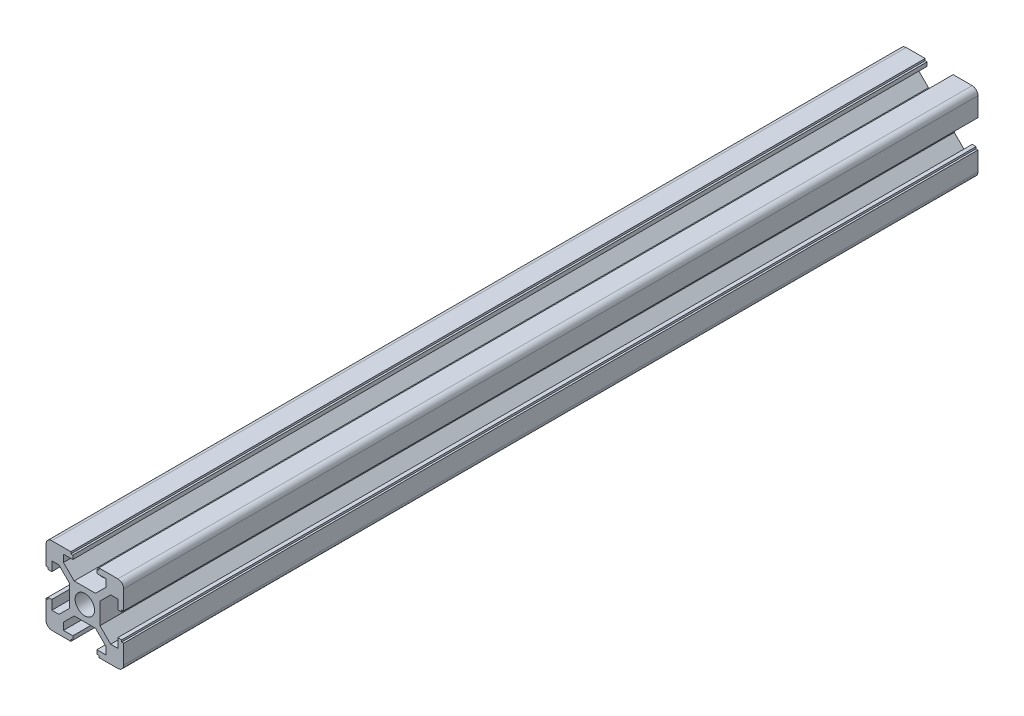
from build123d import *

# Parameters (mm, degrees)
SKETCH1_R           = 2.5
EXTRUDE_1_DEPTH     = 220
SKETCH_1_R          = 1.5
CUT_EXTRUDE_1_DEPTH = 221.665380157


with BuildPart() as part:
    # Sketch1 → 凸台-拉伸1 (new body)
    with BuildSketch(Plane.XY):
        with BuildLine():
            Line((-3.6, 10), (-3.6, 9.5))
            Line((-3.6, 9.5), (-3.1, 9.5))
            Line((-3.1, 9.5), (-3.1, 8.5))
            Line((-3.1, 8.5), (-5.5, 8.5))
            Line((-5.5, 8.5), (-5.5, 6.65))
            Line((-5.5, 6.65), (-2.75, 3.9))
            Line((-2.75, 3.9), (2.75, 3.9))
            Line((2.75, 3.9), (5.5, 6.65))
            Line((5.5, 6.65), (5.5, 8.5))
            Line((5.5, 8.5), (3.1, 8.5))
            Line((3.1, 8.5), (3.1, 9.5))
            Line((3.1, 9.5), (3.6, 9.5))
            Line((3.6, 9.5), (3.6, 10))
            Line((3.6, 10), (8.5, 10))
            ThreePointArc((8.5, 10), (9.560660172, 9.560660172), (10, 8.5))
            Line((10, 8.5), (10, 3.6))
            Line((10, 3.6), (9.5, 3.6))
            Line((9.5, 3.6), (9.5, 3.1))
            Line((9.5, 3.1), (8.5, 3.1))
            Line((8.5, 3.1), (8.5, 5.5))
            Line((8.5, 5.5), (6.65, 5.5))
            Line((6.65, 5.5), (3.9, 2.75))
            Line((3.9, 2.75), (3.9, -2.75))
            Line((3.9, -2.75), (6.65, -5.5))
            Line((6.65, -5.5), (8.5, -5.5))
            Line((8.5, -5.5), (8.5, -3.1))
            Line((8.5, -3.1), (9.5, -3.1))
            Line((9.5, -3.1), (9.5, -3.6))
            Line((9.5, -3.6), (10, -3.6))
            Line((10, -3.6), (10, -8.5))
            ThreePointArc((10, -8.5), (9.560660172, -9.560660172), (8.5, -10))
            Line((8.5, -10), (3.6, -10))
            Line((3.6, -10), (3.6, -9.5))
            Line((3.6, -9.5), (3.1, -9.5))
            Line((3.1, -9.5), (3.1, -8.5))
            Line((3.1, -8.5), (5.5, -8.5))
            Line((5.5, -8.5), (5.5, -6.65))
            Line((5.5, -6.65), (2.75, -3.9))
            Line((2.75, -3.9), (-2.75, -3.9))
            Line((-2.75, -3.9), (-5.5, -6.65))
            Line((-5.5, -6.65), (-5.5, -8.5))
            Line((-5.5, -8.5), (-3.1, -8.5))
            Line((-3.1, -8.5), (-3.1, -9.5))
            Line((-3.1, -9.5), (-3.6, -9.5))
            Line((-3.6, -9.5), (-3.6, -10))
            Line((-3.6, -10), (-8.5, -10))
            ThreePointArc((-8.5, -10), (-9.560660172, -9.560660172), (-10, -8.5))
            Line((-10, -8.5), (-10, -3.6))
            Line((-10, -3.6), (-9.5, -3.6))
            Line((-9.5, -3.6), (-9.5, -3.1))
            Line((-9.5, -3.1), (-8.5, -3.1))
            Line((-8.5, -3.1), (-8.5, -5.5))
            Line((-8.5, -5.5), (-6.65, -5.5))
            Line((-6.65, -5.5), (-3.9, -2.75))
            Line((-3.9, -2.75), (-3.9, 2.75))
            Line((-3.9, 2.75), (-6.65, 5.5))
            Line((-6.65, 5.5), (-8.5, 5.5))
            Line((-8.5, 5.5), (-8.5, 3.1))
            Line((-8.5, 3.1), (-9.5, 3.1))
            Line((-9.5, 3.1), (-9.5, 3.6))
            Line((-9.5, 3.6), (-10, 3.6))
            Line((-10, 3.6), (-10, 8.5))
            ThreePointArc((-10, 8.5), (-9.560660172, 9.560660172), (-8.5, 10))
            Line((-8.5, 10), (-3.6, 10))
        make_face()
        Circle(SKETCH1_R, mode=Mode.SUBTRACT)
    extrude(amount=EXTRUDE_1_DEPTH)

    # 草图1 → 切除-拉伸1 (cut, through all)
    with BuildSketch(Plane(origin=(0, 3.9, 0), x_dir=(1, 0, 0), z_dir=(0, 1, 0))):
        with Locations(Location((0, -214, 0), (0, 0, 180))):
            Circle(SKETCH_1_R)
        with Locations(Location((0, -6, 0), (0, 0, 180))):
            Circle(SKETCH_1_R)
    extrude(amount=-CUT_EXTRUDE_1_DEPTH, mode=Mode.SUBTRACT)


solid = part.part
